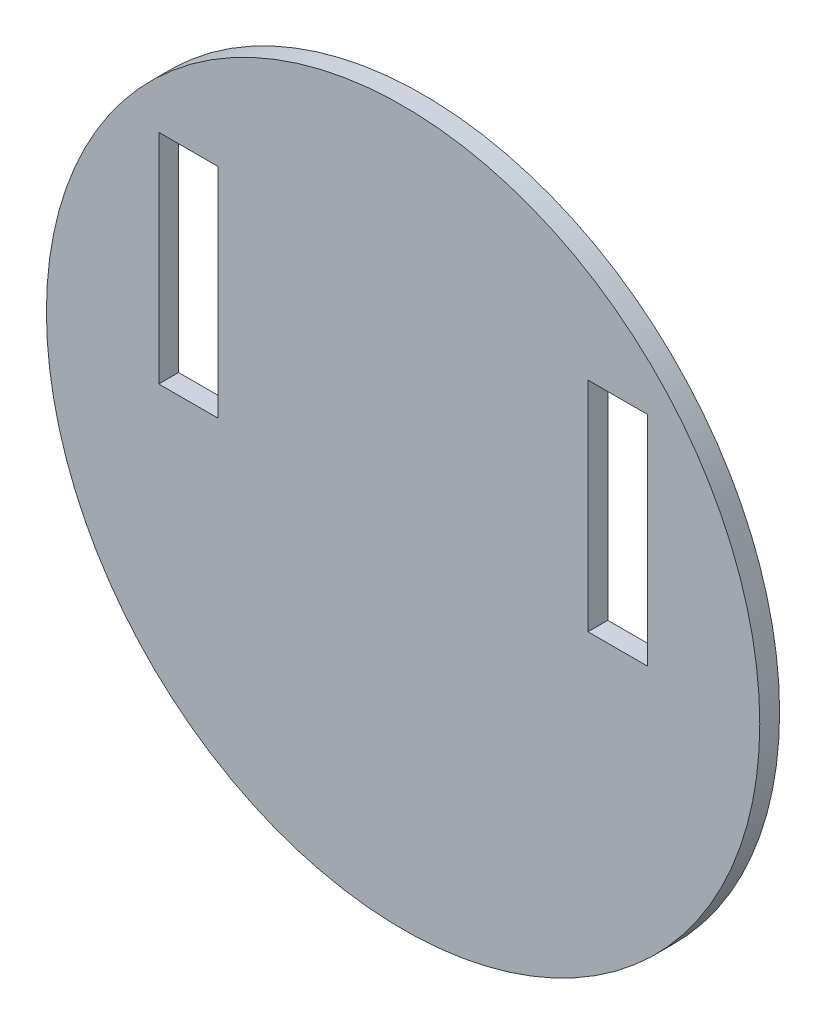
from build123d import *

# Parameters (mm, degrees)
SKETCH2_R           = 90
SKETCH2_W           = 15
SKETCH2_H           = 55
BOSS_EXTRUDE2_DEPTH = 5


with BuildPart() as part:
    # Sketch2 → Boss-Extrude2 (new body)
    with BuildSketch(Plane.XY):
        Circle(SKETCH2_R)
        with Locations((54.145319917, 25.902857051)):
            Rectangle(SKETCH2_W, SKETCH2_H, mode=Mode.SUBTRACT)
        with Locations((-54.145319917, 25.902857051)):
            Rectangle(SKETCH2_W, SKETCH2_H, mode=Mode.SUBTRACT)
    extrude(amount=BOSS_EXTRUDE2_DEPTH)


solid = part.part
